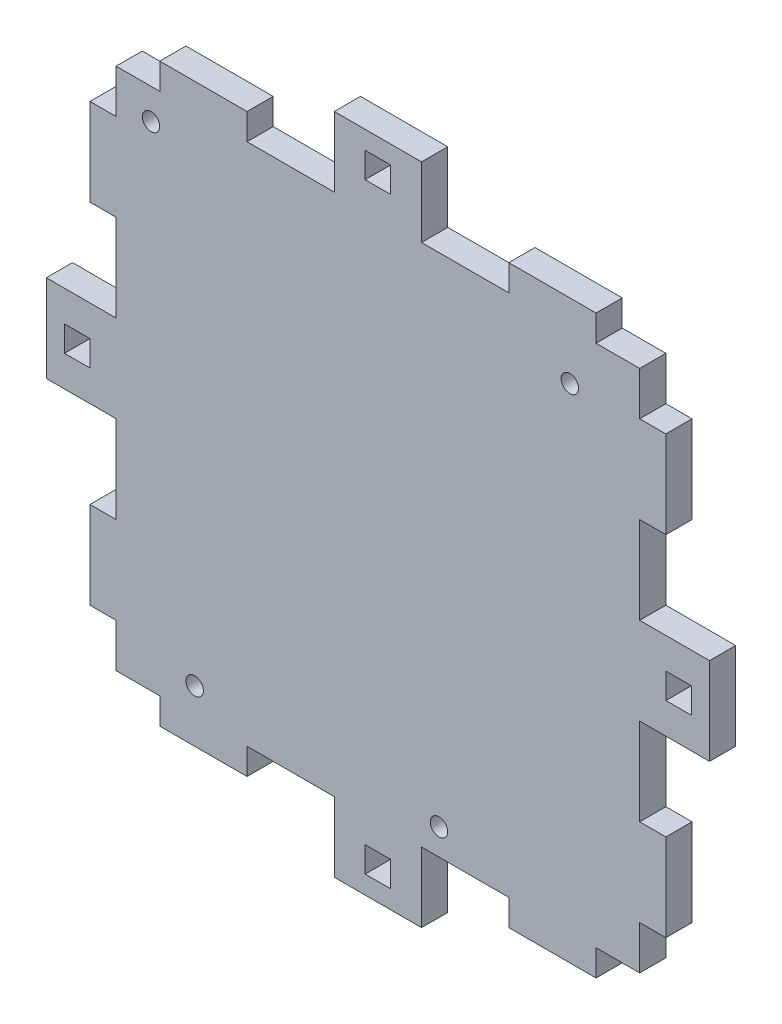
from build123d import *

# Parameters (mm, degrees)
SKETCH1_R           = 1
SKETCH1_W           = 2.92
SKETCH1_H           = 2.92
BOSS_EXTRUDE1_DEPTH = 3


with BuildPart() as part:
    # Sketch1 → Boss-Extrude1 (new body)
    with BuildSketch(Plane.XY):
        Polygon((-16.517509728, 23.247171726), (-16.517509728, 26.247171726), (-26.517509728, 26.247171726), (-26.517509728, 23.247171726), (-31.517509728, 23.247171726), (-31.517509728, 18.247171726), (-34.517509728, 18.247171726), (-34.517509728, 8.247171726), (-31.517509728, 8.247171726), (-31.517509728, -1.752828274), (-39.517509728, -1.752828274), (-39.517509728, -11.752828274), (-31.517509728, -11.752828274), (-31.517509728, -21.752828274), (-34.517509728, -21.752828274), (-34.517509728, -31.752828274), (-31.517509728, -31.752828274), (-31.517509728, -36.752828274), (-26.517509728, -36.752828274), (-26.517509728, -39.752828274), (-16.517509728, -39.752828274), (-16.517509728, -36.752828274), (-6.517509728, -36.752828274), (-6.517509728, -44.752828274), (3.482490272, -44.752828274), (3.482490272, -36.752828274), (13.482490272, -36.752828274), (13.482490272, -39.752828274), (23.482490272, -39.752828274), (23.482490272, -36.752828274), (28.482490272, -36.752828274), (28.482490272, -31.752828274), (31.482490272, -31.752828274), (31.482490272, -21.752828274), (28.482490272, -21.752828274), (28.482490272, -11.752828274), (36.482490272, -11.752828274), (36.482490272, -1.752828274), (28.482490272, -1.752828274), (28.482490272, 8.247171726), (31.482490272, 8.247171726), (31.482490272, 18.247171726), (28.482490272, 18.247171726), (28.482490272, 23.247171726), (23.482490272, 23.247171726), (23.482490272, 26.247171726), (13.482490272, 26.247171726), (13.482490272, 23.247171726), (3.482490272, 23.247171726), (3.482490272, 31.247171726), (-6.517509728, 31.247171726), (-6.517509728, 23.247171726), align=None)
        with Locations((-22.517509728, -33.752828274)):
            Circle(SKETCH1_R, mode=Mode.SUBTRACT)
        with Locations((5.482490272, -33.752828274)):
            Circle(SKETCH1_R, mode=Mode.SUBTRACT)
        with Locations((-27.517509728, 19.747171726)):
            Circle(SKETCH1_R, mode=Mode.SUBTRACT)
        with Locations((20.482490272, 17.747171726)):
            Circle(SKETCH1_R, mode=Mode.SUBTRACT)
        with Locations((-1.517509728, 27.707171726)):
            Rectangle(SKETCH1_W, SKETCH1_H, mode=Mode.SUBTRACT)
        with Locations((-35.977509728, -6.752828274)):
            Rectangle(SKETCH1_W, SKETCH1_H, mode=Mode.SUBTRACT)
        with Locations((32.942490272, -6.752828274)):
            Rectangle(SKETCH1_W, SKETCH1_H, mode=Mode.SUBTRACT)
        with Locations((-1.517509728, -41.212828274)):
            Rectangle(SKETCH1_W, SKETCH1_H, mode=Mode.SUBTRACT)
    extrude(amount=BOSS_EXTRUDE1_DEPTH)


solid = part.part
